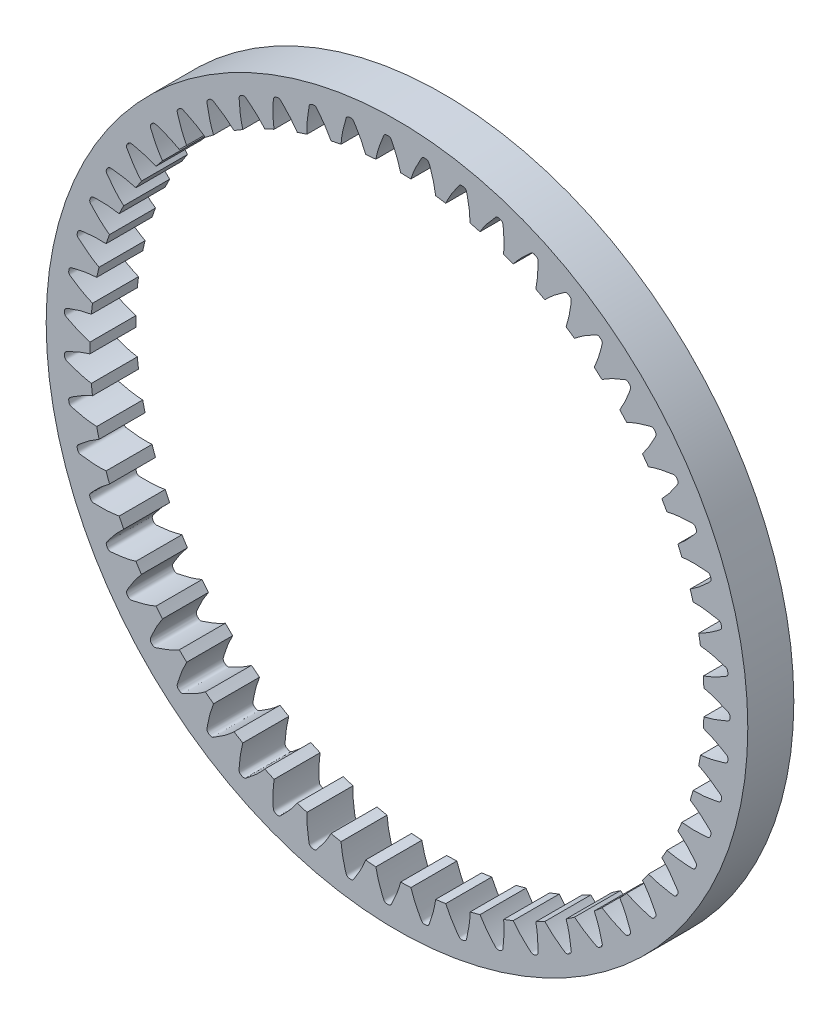
from build123d import *

# Parameters (mm, degrees)
SKETCHREVOLVESPURGEAR_W       = 4
SKETCHREVOLVESPURGEAR_H       = 4.799999985
TOOTHEXTRUDECUTSPURGEAR_DEPTH = 2
PATTERNSPURGEAR_COUNT         = 55
CUT_EXTRUDE2_DEPTH            = 45.592599845
CUT_EXTRUDE2_DEPTH_BACK       = 45.592599845
SKETCH4_R                     = 59.758715027
SKETCH4_R_2                   = 30.5


with BuildPart() as part:
    # SketchRevolveSpurGear → SpurGear (revolve)
    with BuildSketch(Plane(origin=(0, 0, 0), x_dir=(0, 0, -1), z_dir=(1, 0, 0)), mode=Mode.PRIVATE) as spurgear_sk:
        with Locations((0, 29.099999595)):
            Rectangle(SKETCHREVOLVESPURGEAR_W, SKETCHREVOLVESPURGEAR_H)
    revolve(spurgear_sk.sketch.rotate(Axis((0, 0, 0), (0, 0, -1)), 90), axis=Axis((0, 0, 0), (0, 0, -1)))

    # SketchToothSpurGear → ToothExtrudeCutSpurGear (cut, symmetric)
    with BuildSketch(Plane.XY):
        with BuildLine():
            ThreePointArc((26.661143645, -1.084352278), (26.683185723, 0), (26.661143645, 1.084352278))
            add(Edge.make_bspline(
                [(26.661143645, 1.084352278), (26.771290932, 1.060729715), (26.942432435, 1.019513731), (27.177626463, 0.954455679), (27.372992959, 0.895487945), (27.580268016, 0.827614446), (27.799153728, 0.750289731), (28.029240353, 0.662776702), (28.270468231, 0.565171604), (28.521257548, 0.454250779), (28.706807509, 0.374356526), (28.81694733, 0.315508201), (28.850580128, 0.289068648), (28.880055853, 0.258815186), (28.904962557, 0.224651266), (28.924808622, 0.187345426), (28.944073727, 0.134927799), (28.95060676, 0.082097448), (28.949865742, 0.032743292), (28.950066481, 0), (28.949865742, -0.032743292), (28.95060676, -0.082097448), (28.944073727, -0.134927799), (28.924808622, -0.187345426), (28.904962557, -0.224651266), (28.880055853, -0.258815186), (28.850580128, -0.289068648), (28.81694733, -0.315508201), (28.706807509, -0.374356526), (28.521257548, -0.454250779), (28.270468231, -0.565171604), (28.029240353, -0.662776702), (27.799153728, -0.750289731), (27.580268016, -0.827614446), (27.372992959, -0.895487945), (27.177626463, -0.954455679), (26.942432435, -1.019513731), (26.771290932, -1.060729715), (26.661143645, -1.084352278)],
                knots=[0, 0, 0, 0, 0.06368261, 0.099490553, 0.137942921, 0.179039714, 0.222780933, 0.269166577, 0.318196646, 0.36987114, 0.424190059, 0.432383721, 0.440322313, 0.448260906, 0.456199498, 0.46413809, 0.472076683, 0.487661443, 0.493830726, 0.5, 0.506169274, 0.512338557, 0.527923317, 0.53586191, 0.543800502, 0.551739094, 0.559677687, 0.567616279, 0.575809941, 0.63012886, 0.681803354, 0.730833423, 0.777219067, 0.820960286, 0.862057079, 0.900509447, 0.93631739, 1, 1, 1, 1], degree=3))
        make_face()
    toothextrudecutspurgear = extrude(amount=TOOTHEXTRUDECUTSPURGEAR_DEPTH, both=True, mode=Mode.SUBTRACT)

    # PatternSpurGear: ToothExtrudeCutSpurGear ×55 about axis
    patternspurgear_axis = Axis((0, 0, 55), (0, 0, -1))
    for i in range(1, PATTERNSPURGEAR_COUNT):
        add(toothextrudecutspurgear.rotate(patternspurgear_axis, i * 360 / PATTERNSPURGEAR_COUNT), mode=Mode.SUBTRACT)

    # Sketch4 → Cut-Extrude2 (cut, two sides: drawn at the far end of the back side and taken through both)
    with BuildSketch(Plane.XY.offset(-CUT_EXTRUDE2_DEPTH_BACK)):
        Circle(SKETCH4_R)
        Circle(SKETCH4_R_2, mode=Mode.SUBTRACT)
    extrude(amount=CUT_EXTRUDE2_DEPTH + CUT_EXTRUDE2_DEPTH_BACK, mode=Mode.SUBTRACT)


solid = part.part
